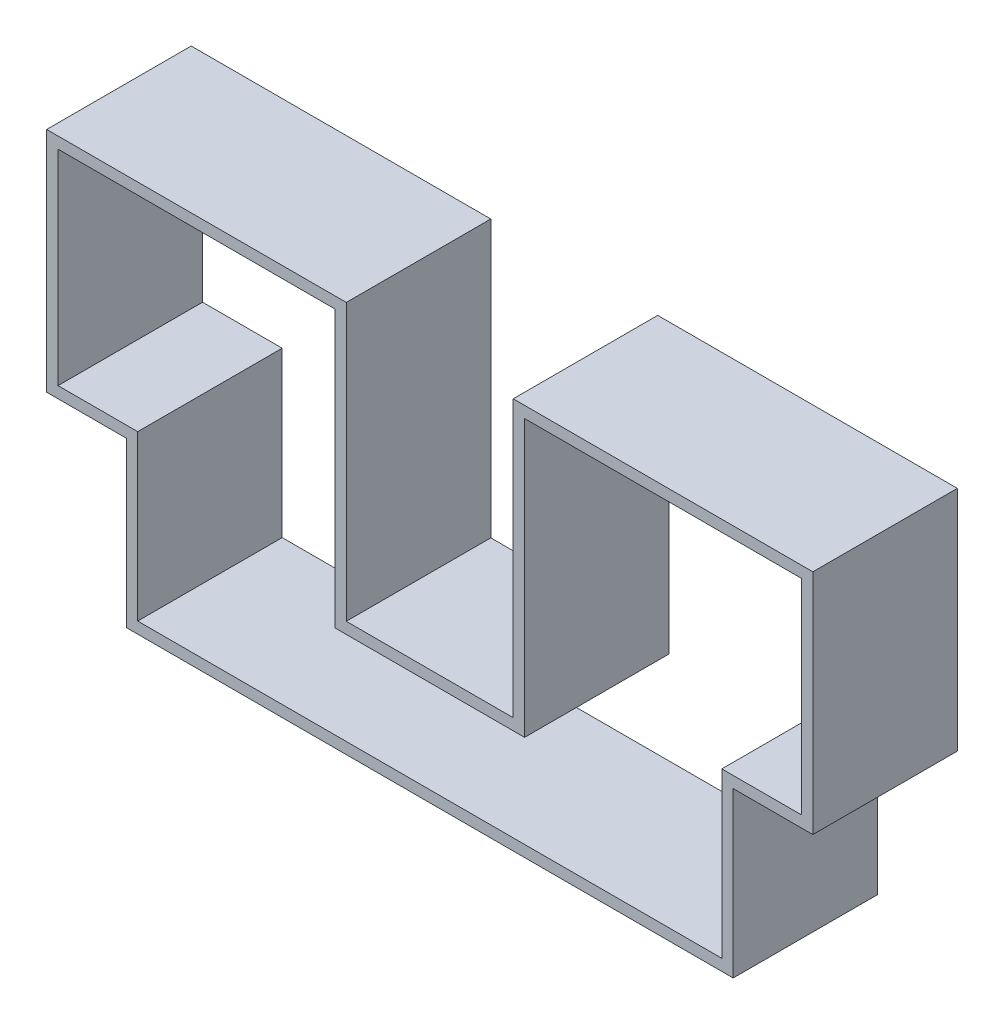
from build123d import *

# Parameters (mm, degrees)
BOSS_EXTRUDE1_DEPTH = 38.1
SHELL2_T            = -3


with BuildPart() as part:
    # Sketch1 → Boss-Extrude1 (new body)
    with BuildSketch(Plane.XY):
        Polygon((80, 0), (-80, 0), (-80, 43.25), (-101, 43.25), (-101, 103.25), (-22.006, 103.25), (-22.006, 30.441483681), (22.006, 30.441483681), (22.006, 103.25), (101, 103.25), (101, 43.25), (80, 43.25), align=None)
    extrude(amount=BOSS_EXTRUDE1_DEPTH)

    # Shell2
    shell2_openings = [part.faces().sort_by_distance(p)[0] for p in [
        (0, 2.268580228, 38.1),
        (0, 2.268580228, 0),
    ]]
    offset(amount=SHELL2_T, openings=shell2_openings, kind=Kind.INTERSECTION)


solid = part.part
